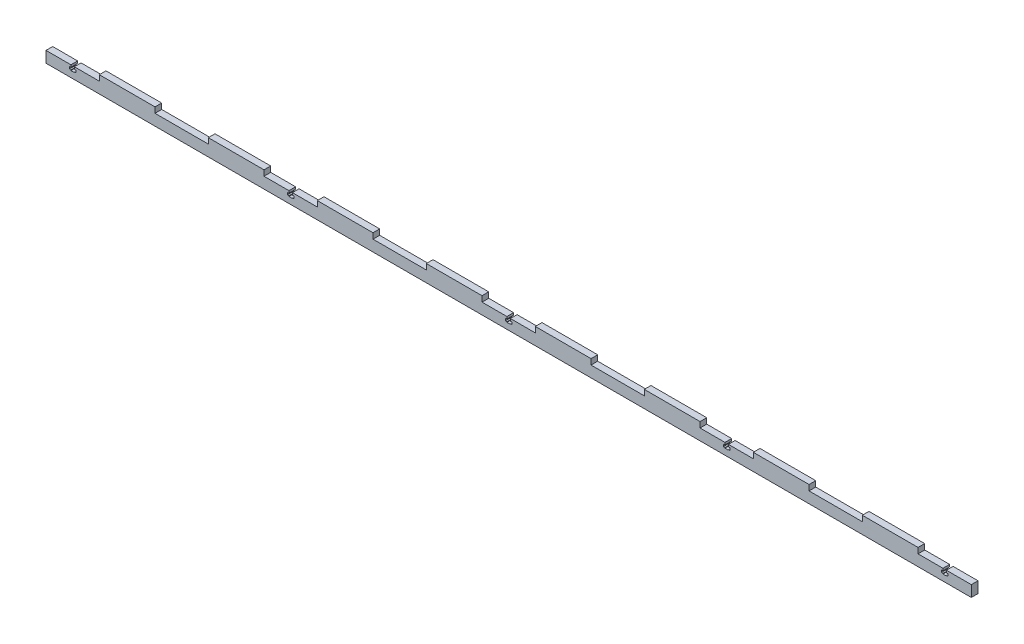
from build123d import *

# Parameters (mm, degrees)
SZKIC1_W                    = 830
SZKIC1_H                    = 16
DODANIE_WYCI_GNI_CIE1_DEPTH = 6
SZKIC2_W                    = 47.778
SZKIC2_H                    = 6
WYTNIJ_WYCI_GNI_CIE1_DEPTH  = 6
SZYK_LINIOWY1_COUNT         = 9
SZYK_LINIOWY1_PITCH         = 97.778
WYTNIJ_WYCI_GNI_CIE2_DEPTH  = 6
SZYK_LINIOWY2_COUNT         = 5
SZYK_LINIOWY2_PITCH         = 195.56
SZKIC5_W                    = 734.446
SZKIC5_H                    = 1
WYTNIJ_WYCI_GNI_CIE3_DEPTH  = 10


with BuildPart() as part:
    # Szkic1 → Dodanie-wyciągnięcie1 (new body)
    with BuildSketch(Plane.XY):
        with Locations((415, 8)):
            Rectangle(SZKIC1_W, SZKIC1_H)
    extrude(amount=DODANIE_WYCI_GNI_CIE1_DEPTH)

    # Szkic2 → Wytnij-wyciągnięcie1 (cut)
    with BuildSketch(Plane(origin=(0, 16, 0), x_dir=(1, 0, 0), z_dir=(0, 1, 0))):
        with Locations((806.111, -3)):
            Rectangle(SZKIC2_W, SZKIC2_H)
    wytnij_wyci_gni_cie1 = extrude(amount=-WYTNIJ_WYCI_GNI_CIE1_DEPTH, mode=Mode.SUBTRACT)

    # Szyk liniowy1: Wytnij-wyciągnięcie1 ×9
    with Locations(*[(-i * SZYK_LINIOWY1_PITCH, 0, 0) for i in range(1, SZYK_LINIOWY1_COUNT)]):
        add(wytnij_wyci_gni_cie1, mode=Mode.SUBTRACT)

    # Szkic4 → Wytnij-wyciągnięcie2 (cut)
    with BuildSketch(Plane.XY.offset(6)):
        Polygon((22.34, 10), (25.44, 10), (25.44, 8), (26.815, 8), (26.815, 6), (25.44, 6), (25.44, 5.5), (22.34, 5.5), (22.34, 6), (20.965, 6), (20.965, 8), (22.34, 8), align=None)
    wytnij_wyci_gni_cie2 = extrude(amount=-WYTNIJ_WYCI_GNI_CIE2_DEPTH, mode=Mode.SUBTRACT)

    # Szyk liniowy2: Wytnij-wyciągnięcie2 ×5
    with Locations(*[(i * SZYK_LINIOWY2_PITCH, 0, 0) for i in range(1, SZYK_LINIOWY2_COUNT)]):
        add(wytnij_wyci_gni_cie2, mode=Mode.SUBTRACT)

    # Szkic5 → Wytnij-wyciągnięcie3 (cut)
    with BuildSketch(Plane.XY.offset(6)):
        with Locations((414.999, 15.5)):
            Rectangle(SZKIC5_W, SZKIC5_H)
    extrude(amount=-WYTNIJ_WYCI_GNI_CIE3_DEPTH, mode=Mode.SUBTRACT)


solid = part.part
